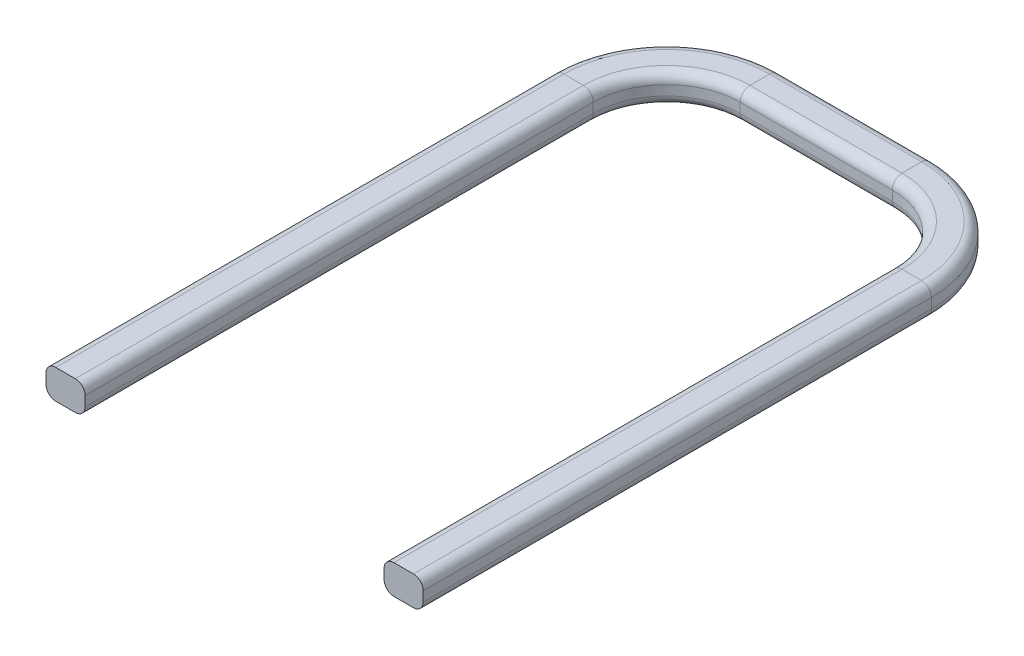
from build123d import *

# Parameters (mm, degrees)
SKETCH1_W = 1
SKETCH1_H = 0.75
FILLET1_R = 0.25


with BuildPart() as part:
    # Sweep1: sweep along a path in Sketch2
    with BuildLine(Plane(origin=(0, 0, 0), x_dir=(1, 0, 0), z_dir=(0, 1, 0))) as sweep1_path:
        Line((0, 0), (0, 13))
        ThreePointArc((0, 13), (0.697085861, 14.682914139), (2.38, 15.38))
        Line((2.38, 15.38), (6.27, 15.38))
        ThreePointArc((6.27, 15.38), (7.952914139, 14.682914139), (8.65, 13))
        Line((8.65, 13), (8.65, 0))
    # Sketch1 → Sweep1 (sweep)
    with BuildSketch(Plane.XY):
        Rectangle(SKETCH1_W, SKETCH1_H)
    sweep(path=sweep1_path.line)

    # Fillet1
    fillet1_edges = [part.edges().sort_by_distance(p)[0] for p in [
        (9.15, -0.375, -6.5),
        (8.15, -0.375, -6.5),
        (8.15, 0.375, -6.5),
        (-0.5, 0.375, -6.5),
        (-0.5, -0.375, -6.5),
        (0.5, -0.375, -6.5),
        (0.5, 0.375, -6.5),
        (0.34353247, 0.375, -15.03646753),
        (0.34353247, -0.375, -15.03646753),
        (1.050639251, -0.375, -14.329360749),
        (1.050639251, 0.375, -14.329360749),
        (4.325, 0.375, -15.88),
        (4.325, -0.375, -15.88),
        (4.325, -0.375, -14.88),
        (4.325, 0.375, -14.88),
        (8.30646753, 0.375, -15.03646753),
        (8.30646753, -0.375, -15.03646753),
        (7.599360749, -0.375, -14.329360749),
        (7.599360749, 0.375, -14.329360749),
        (9.15, 0.375, -6.5),
    ]]
    fillet(fillet1_edges, radius=FILLET1_R)


solid = part.part
